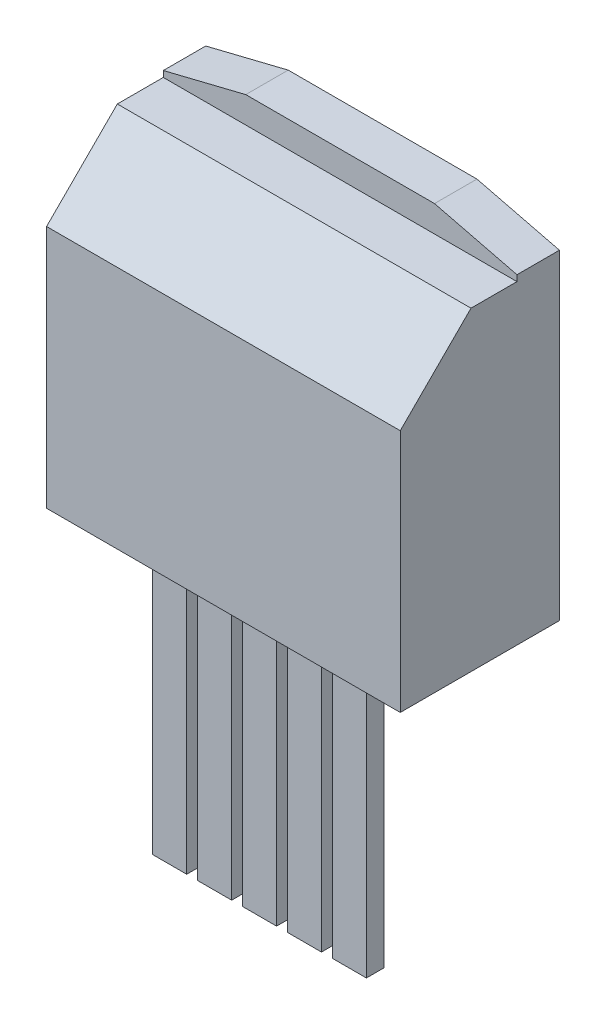
from build123d import *

# Parameters (mm, degrees)
SKETCH_1_W          = 10
SKETCH_1_H          = 15.4
EXTRUDE_1_DEPTH     = 4.5
SKETCH_2_W          = 10
SKETCH_2_H          = 6.5
CUT_EXTRUDE_1_DEPTH = 3.3
CHAMFER_1_SIZE      = 2
CUT_EXTRUDE_2_DEPTH = 10
SKETCH_4_W          = 0.965597518
SKETCH_4_H          = 0.5
EXTRUDE_2_DEPTH     = 8


with BuildPart() as part:
    # 草图1 → 凸台-拉伸1 (new body)
    with BuildSketch(Plane.XY):
        with Locations((0, 7.7)):
            Rectangle(SKETCH_1_W, SKETCH_1_H)
    extrude(amount=EXTRUDE_1_DEPTH)

    # 草图2 → 切除-拉伸1 (cut)
    with BuildSketch(Plane.XY.offset(4.5)):
        with Locations((0, 12.15)):
            Rectangle(SKETCH_2_W, SKETCH_2_H)
    extrude(amount=-CUT_EXTRUDE_1_DEPTH, mode=Mode.SUBTRACT)

    # 倒角1
    chamfer_1_edges = [part.edges().sort_by_distance(p)[0] for p in [
        (0, 8.9, 4.5),
    ]]
    chamfer(chamfer_1_edges, length=CHAMFER_1_SIZE)

    # 草图5 → 切除-拉伸2 (cut)
    with BuildSketch(Plane.XY.offset(1.2)):
        Polygon((-5, 9.069569731), (-2.668025146, 9.645356545), (2.668025146, 9.645356545), (5, 9.069569731), (5, 15.4), (-5, 15.4), align=None)
    extrude(amount=-CUT_EXTRUDE_2_DEPTH, mode=Mode.SUBTRACT)

    # 草图4 → 凸台-拉伸2 (add)
    with BuildSketch(Plane.XZ):
        with Locations((1.27, 3.23)):
            Rectangle(SKETCH_4_W, SKETCH_4_H)
        with Locations((0, 3.23)):
            Rectangle(SKETCH_4_W, SKETCH_4_H)
        with Locations((-1.27, 3.23)):
            Rectangle(SKETCH_4_W, SKETCH_4_H)
        with Locations((-2.54, 3.23)):
            Rectangle(SKETCH_4_W, SKETCH_4_H)
        with Locations((2.54, 3.23)):
            Rectangle(SKETCH_4_W, SKETCH_4_H)
    extrude(amount=EXTRUDE_2_DEPTH)


solid = part.part
